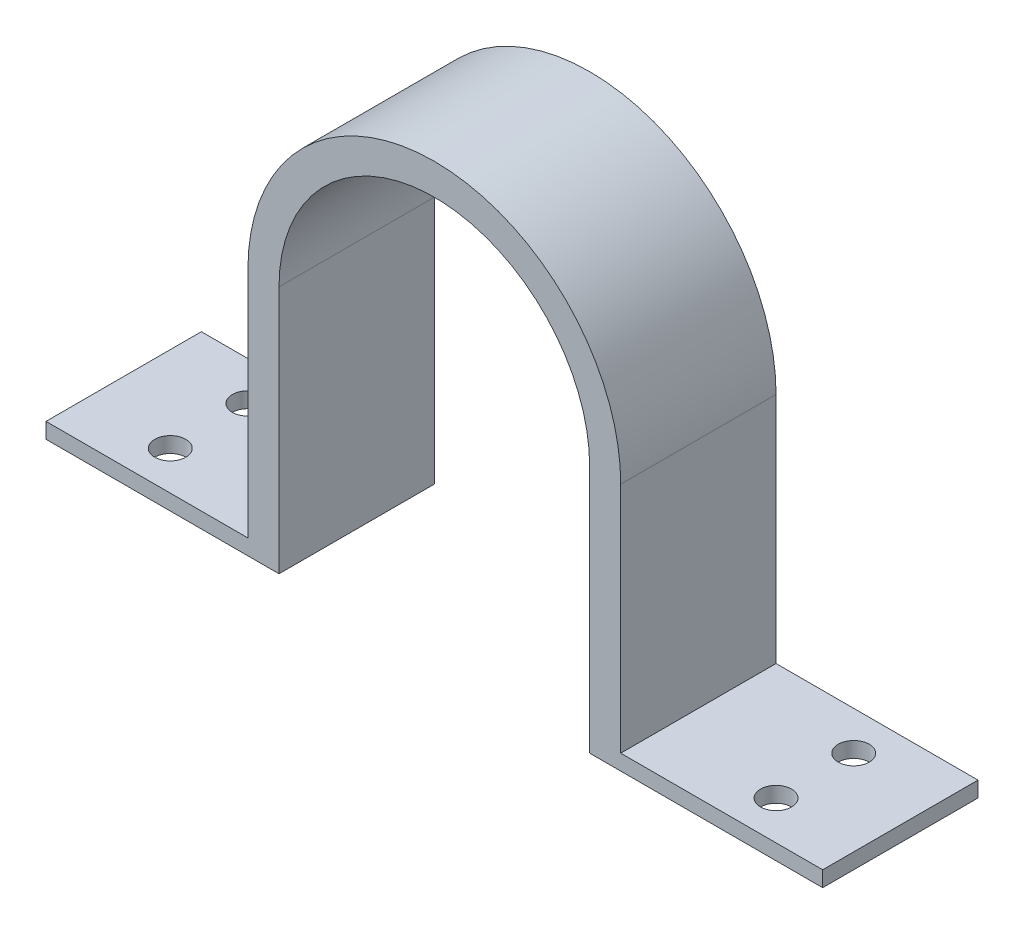
from build123d import *

# Parameters (mm, degrees)
BOSS_EXTRUDE1_DEPTH = 20
SKETCH2_R           = 2
CUT_EXTRUDE1_DEPTH  = 81.324342512


with BuildPart() as part:
    # Sketch1 → Boss-Extrude1 (new body)
    with BuildSketch(Plane.XY):
        with BuildLine():
            Line((-18, 0), (-18, 30))
            ThreePointArc((-18, 30), (6, 54), (30, 30))
            Line((30, 30), (30, 0))
            Line((30, 0), (56, 0))
            Line((56, 0), (56, -2))
            Line((56, -2), (26, -2))
            Line((26, -2), (26, 0))
            Line((26, 0), (26, 30))
            ThreePointArc((26, 30), (6, 50), (-14, 30))
            Line((-14, 30), (-14, 0))
            Line((-14, 0), (-14, -2))
            Line((-14, -2), (-44, -2))
            Line((-44, -2), (-44, 0))
            Line((-44, 0), (-18, 0))
        make_face()
    extrude(amount=BOSS_EXTRUDE1_DEPTH)

    # Sketch2 → Cut-Extrude1 (cut, through all)
    with BuildSketch(Plane(origin=(0, 0, 0), x_dir=(1, 0, 0), z_dir=(0, 1, 0))):
        with Locations(Location((-33, -5, 0), (0, 0, 180))):
            Circle(SKETCH2_R)
        with Locations(Location((-33, -15, 0), (0, 0, 180))):
            Circle(SKETCH2_R)
        with Locations(Location((45, -5, 0), (0, 0, 180))):
            Circle(SKETCH2_R)
        with Locations((45, -15)):
            Circle(SKETCH2_R)
    extrude(amount=-CUT_EXTRUDE1_DEPTH, mode=Mode.SUBTRACT)


solid = part.part
